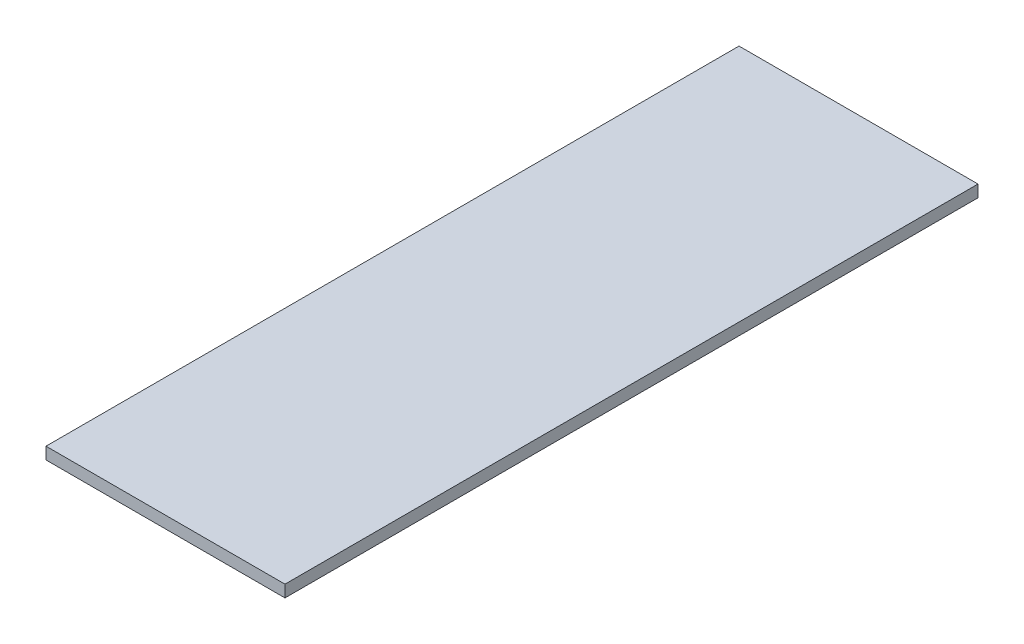
from build123d import *

# Parameters (mm, degrees)
ESQUISSE1_W        = 200
ESQUISSE1_H        = 580
BOSS_EXTRU_1_DEPTH = 10


with BuildPart() as part:
    # Esquisse1 → Boss.-Extru.1 (new body)
    with BuildSketch(Plane(origin=(0, 0, 0), x_dir=(1, 0, 0), z_dir=(0, 1, 0))):
        with Locations((100, 290)):
            Rectangle(ESQUISSE1_W, ESQUISSE1_H)
    extrude(amount=BOSS_EXTRU_1_DEPTH)


solid = part.part
